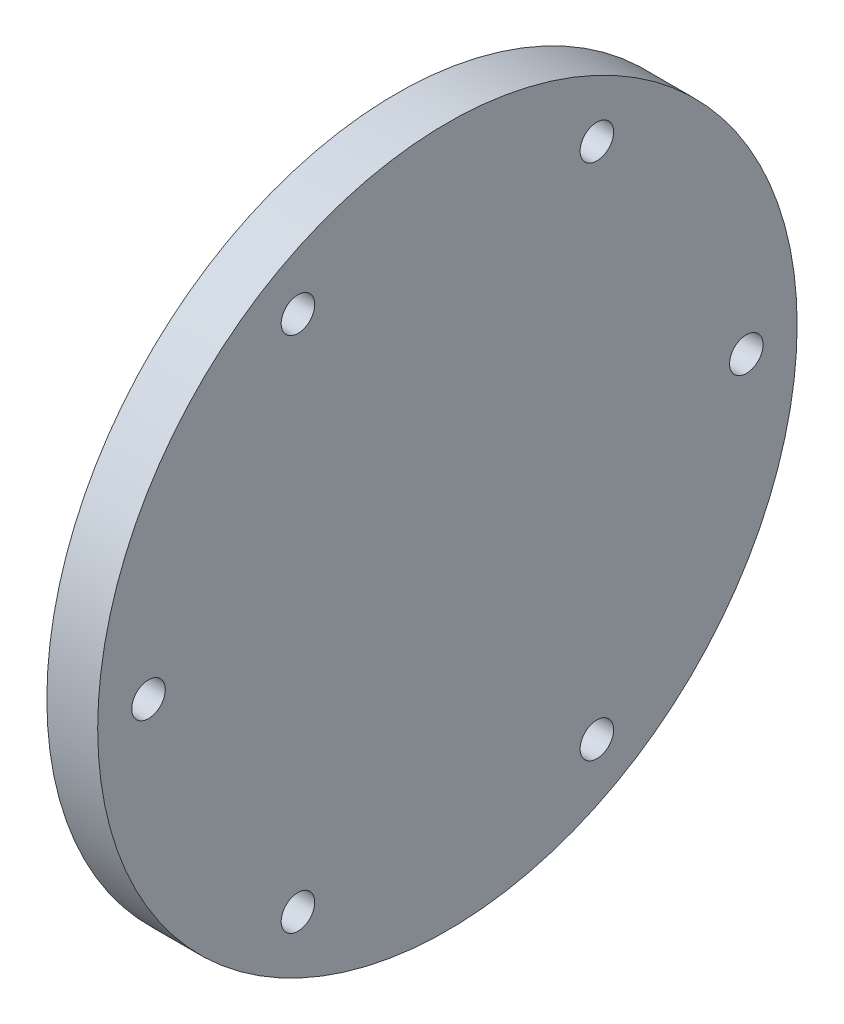
from build123d import *

# Parameters (mm, degrees)
AXIAL_PROFILE_MM_W     = 5
AXIAL_PROFILE_MM_H     = 34.4
AXIAL_HOLES_DEPTH      = 176.574514096
AXIAL_HOLES_DEPTH_BACK = 176.574514096
SKETCH2_R              = 1.65


with BuildPart() as part:
    # Axial profile (mm) → Full revolution (revolve)
    with BuildSketch(Plane.XY, mode=Mode.PRIVATE) as full_revolution_sk:
        with Locations((166.2, 17.2)):
            Rectangle(AXIAL_PROFILE_MM_W, AXIAL_PROFILE_MM_H)
    revolve(full_revolution_sk.sketch.rotate(Axis((-110, 0, 0), (1, 0, 0)), 90), axis=Axis((-110, 0, 0), (1, 0, 0)))

    # Sketch2 → Axial holes (cut, two sides: drawn at the far end of the back side and taken through both)
    with BuildSketch(Plane(origin=(0, 0, 0), x_dir=(0, 0, -1), z_dir=(1, 0, 0)).offset(-AXIAL_HOLES_DEPTH_BACK)):
        with Locations((-29.4, 0)):
            Circle(SKETCH2_R)
        with Locations((14.7, -25.461146871)):
            Circle(SKETCH2_R)
        with Locations((14.7, 25.461146871)):
            Circle(SKETCH2_R)
        with Locations((29.4, 0)):
            Circle(SKETCH2_R)
        with Locations((-14.7, 25.461146871)):
            Circle(SKETCH2_R)
        with Locations((-14.7, -25.461146871)):
            Circle(SKETCH2_R)
    extrude(amount=AXIAL_HOLES_DEPTH + AXIAL_HOLES_DEPTH_BACK, mode=Mode.SUBTRACT)


solid = part.part
